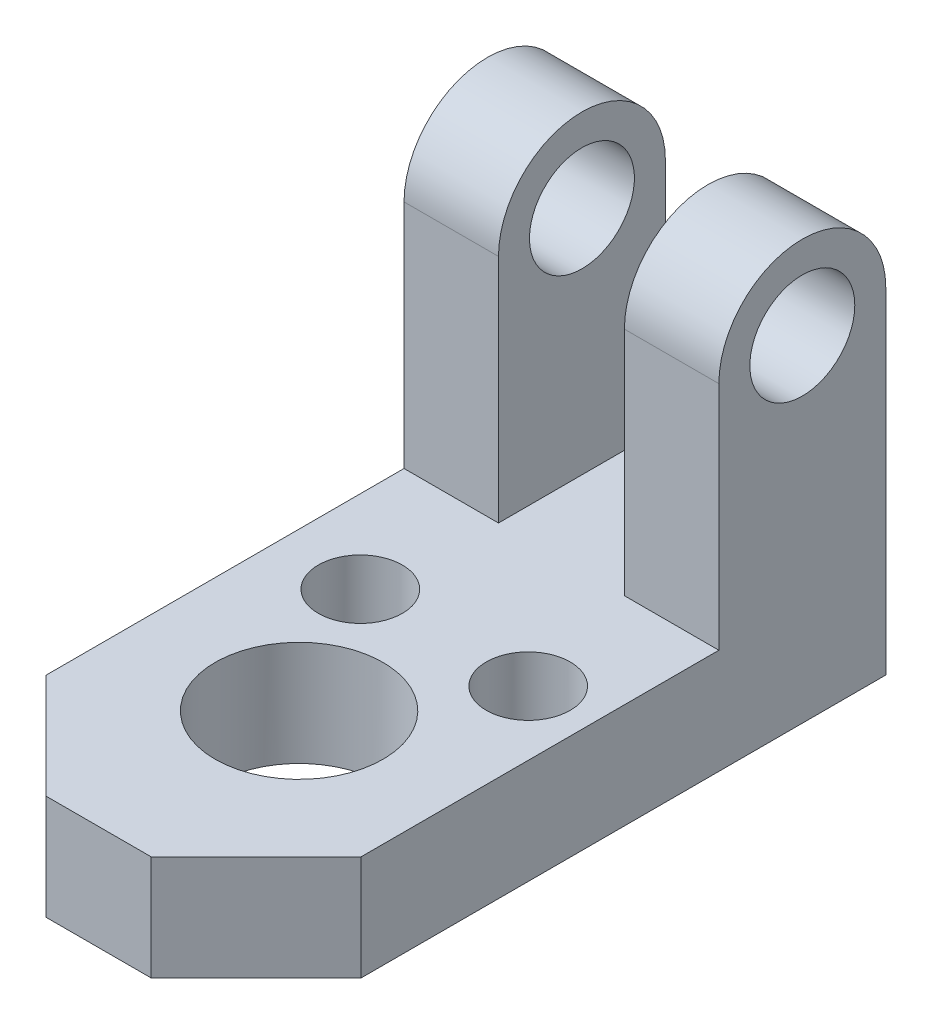
from build123d import *

# Parameters (mm, degrees)
SKETCH2_W           = 30
SKETCH2_H           = 60
BOSS_EXTRUDE1_DEPTH = 10
CHAMFER1_SIZE       = 10
CHAMFER2_SIZE       = 10
SKETCH3_W           = 15.904721494
SKETCH3_H           = 22
BOSS_EXTRUDE2_DEPTH = 9
CUT_EXTRUDE4_REACH  = 56.771
SKETCH5_R           = 8
SKETCH6_R           = 7.952360747
BOSS_EXTRUDE3_DEPTH = 9
CUT_EXTRUDE5_REACH  = 70.795
SKETCH8_R           = 5
CUT_EXTRUDE6_REACH  = 60.421
SKETCH9_R           = 4


with BuildPart() as part:
    # Sketch2 → Boss-Extrude1 (new body)
    with BuildSketch(Plane(origin=(0, 0, 0), x_dir=(1, 0, 0), z_dir=(0, 1, 0))):
        with Locations((-1.70984456, 17.292746114)):
            Rectangle(SKETCH2_W, SKETCH2_H)
    extrude(amount=BOSS_EXTRUDE1_DEPTH)

    # Chamfer1
    chamfer1_edges = [part.edges().sort_by_distance(p)[0] for p in [
        (-16.70984456, 5, 12.707253886),
    ]]
    chamfer(chamfer1_edges, length=CHAMFER1_SIZE)

    # Chamfer2
    chamfer2_edges = [part.edges().sort_by_distance(p)[0] for p in [
        (13.29015544, 5, 12.707253886),
    ]]
    chamfer(chamfer2_edges, length=CHAMFER2_SIZE)

    # Sketch3 → Boss-Extrude2 (add)
    with BuildSketch(Plane(origin=(13.29015544, 0, 0), x_dir=(0, 0, -1), z_dir=(1, 0, 0))):
        with Locations((39.340385367, 21)):
            Rectangle(SKETCH3_W, SKETCH3_H)
    boss_extrude2 = extrude(amount=-BOSS_EXTRUDE2_DEPTH)

    # Sketch5 → Cut-Extrude4 (cut, up to next)
    with BuildSketch(Plane(origin=(0, 10, 0), x_dir=(1, 0, 0), z_dir=(0, 1, 0)), mode=Mode.PRIVATE) as cut_extrude4_sk1:
        with Locations(Location((-1.70984456, 6.38802462, 0), (0, 0, 270))):
            Circle(SKETCH5_R)
    cut_extrude4_tool1 = extrude(cut_extrude4_sk1.sketch, amount=-CUT_EXTRUDE4_REACH, mode=Mode.PRIVATE) & part.part
    add(cut_extrude4_tool1.solids().sort_by_distance((-1.709845, 10, -6.388025))[0], mode=Mode.SUBTRACT)

    # Sketch6 → Boss-Extrude3 (add)
    with BuildSketch(Plane(origin=(13.29015544, 0, 0), x_dir=(0, 0, -1), z_dir=(1, 0, 0))):
        with Locations((39.340385367, 32)):
            Circle(SKETCH6_R)
    boss_extrude3 = extrude(amount=-BOSS_EXTRUDE3_DEPTH)

    # Sketch8 → Cut-Extrude5 (cut, up to next)
    with BuildSketch(Plane(origin=(13.29015544, 0, 0), x_dir=(0, 0, -1), z_dir=(1, 0, 0)), mode=Mode.PRIVATE) as cut_extrude5_sk1:
        with Locations((39.340385367, 32)):
            Circle(SKETCH8_R)
    cut_extrude5_tool1 = extrude(cut_extrude5_sk1.sketch, amount=-CUT_EXTRUDE5_REACH, mode=Mode.PRIVATE) & part.part
    cut_extrude5 = cut_extrude5_tool1.solids().sort_by_distance((13.290155, 32, -39.340385))[0]
    add(cut_extrude5, mode=Mode.SUBTRACT)

    # Mirror6: Boss-Extrude2, Boss-Extrude3, Cut-Extrude5 across plane
    add(boss_extrude2.mirror(Plane.ZY.offset(1.70984456)))
    add(boss_extrude3.mirror(Plane.ZY.offset(1.70984456)))
    add(cut_extrude5.mirror(Plane.ZY.offset(1.70984456)), mode=Mode.SUBTRACT)

    # Sketch9 → Cut-Extrude6 (cut, up to next)
    with BuildSketch(Plane(origin=(0, 10, 0), x_dir=(1, 0, 0), z_dir=(0, 1, 0)), mode=Mode.PRIVATE) as cut_extrude6_sk1:
        with Locations(Location((-8.831623879, 19.34363435, 0), (0, 0, 270))):
            Circle(SKETCH9_R)
    cut_extrude6_tool1 = extrude(cut_extrude6_sk1.sketch, amount=-CUT_EXTRUDE6_REACH, mode=Mode.PRIVATE) & part.part
    # Sketch9 → Cut-Extrude6 (cut, up to next)
    with BuildSketch(Plane(origin=(0, 10, 0), x_dir=(1, 0, 0), z_dir=(0, 1, 0)), mode=Mode.PRIVATE) as cut_extrude6_sk2:
        with Locations(Location((7.168376121, 19.34363435, 0), (0, 0, 270))):
            Circle(SKETCH9_R)
    cut_extrude6_tool2 = extrude(cut_extrude6_sk2.sketch, amount=-CUT_EXTRUDE6_REACH, mode=Mode.PRIVATE) & part.part
    add(cut_extrude6_tool1.solids().sort_by_distance((-8.831624, 10, -19.343634))[0], mode=Mode.SUBTRACT)
    add(cut_extrude6_tool2.solids().sort_by_distance((7.168376, 10, -19.343634))[0], mode=Mode.SUBTRACT)


solid = part.part
